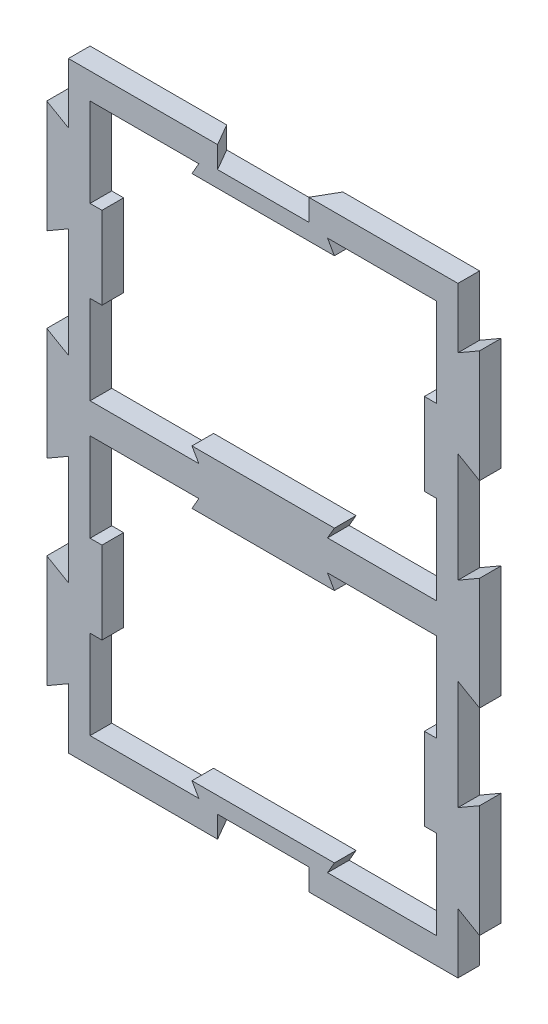
from build123d import *

# Parameters (mm, degrees)
SKETCH2_W           = 139
SKETCH2_H           = 90
SKETCH2_W_2         = 60
SKETCH2_H_2         = 80
BOSS_EXTRUDE1_DEPTH = 5
CUT_EXTRUDE5_DEPTH  = 5
CUT_EXTRUDE6_START  = 134
CUT_EXTRUDE6_DEPTH  = 5
SKETCH12_W          = 2.75
SKETCH12_H          = 19
BOSS_EXTRUDE2_DEPTH = 5


with BuildPart() as part:
    # Sketch2 → Boss-Extrude1 (new body)
    with BuildSketch(Plane(origin=(0, 0, 0), x_dir=(0, 1, 0), z_dir=(0, 0, 1))):
        Rectangle(SKETCH2_W, SKETCH2_H)
        with Locations((33.5, 0)):
            Rectangle(SKETCH2_W_2, SKETCH2_H_2, mode=Mode.SUBTRACT)
        with Locations((-33.5, 0)):
            Rectangle(SKETCH2_W_2, SKETCH2_H_2, mode=Mode.SUBTRACT)
    extrude(amount=BOSS_EXTRUDE1_DEPTH)

    # Sketch13 → Cut-Extrude5 (cut)
    with BuildSketch(Plane(origin=(0, -69.5, -60), x_dir=(1, 0, 0), z_dir=(0, 1, 0))):
        Polygon((-13.423393759, -60), (13.423393759, -60), (0, -83.25), align=None)
    extrude(amount=CUT_EXTRUDE5_DEPTH, mode=Mode.SUBTRACT)

    # Sketch13<3> → Cut-Extrude6 (cut)
    with BuildSketch(Plane(origin=(0, -69.5, -60), x_dir=(1, 0, 0), z_dir=(0, 1, 0)).offset(CUT_EXTRUDE6_START)):
        Polygon((-13.423393759, -60), (13.423393759, -60), (0, -83.25), align=None)
    extrude(amount=CUT_EXTRUDE6_DEPTH, mode=Mode.SUBTRACT)

    # Sketch12 → Boss-Extrude2 (add)
    with BuildSketch(Plane.XY.offset(5)):
        Polygon((-50, 32.519237886), (-45, 35.405989232), (-45, 55.613248654), (-50, 58.5), align=None)
        Polygon((-45, -10.103629711), (-45, 10.103629711), (-50, 12.990381057), (-50, -12.990381057), align=None)
        with Locations((-38.625, 33.5)):
            Rectangle(SKETCH12_W, SKETCH12_H)
        Polygon((-45, -55.613248654), (-45, -35.405989232), (-50, -32.519237886), (-50, -58.5), align=None)
        Polygon((-16.454482672, 6.25), (-14.866769432, 3.5), (14.866769432, 3.5), (16.454482672, 6.25), align=None)
        with Locations((-38.625, -33.5)):
            Rectangle(SKETCH12_W, SKETCH12_H)
        Polygon((14.866769432, 63.5), (-14.866769432, 63.5), (-16.454482672, 60.75), (16.454482672, 60.75), align=None)
        Polygon((-14.866769432, -3.5), (-16.454482672, -6.25), (16.454482672, -6.25), (14.866769432, -3.5), align=None)
        Polygon((-16.454482672, -60.75), (-14.866769432, -63.5), (14.866769432, -63.5), (16.454482672, -60.75), align=None)
        Polygon((50, 58.5), (45, 55.613248654), (45, 35.405989232), (50, 32.519237886), align=None)
        with Locations((38.625, 33.5)):
            Rectangle(SKETCH12_W, SKETCH12_H)
        Polygon((45, -35.405989232), (45, -55.613248654), (50, -58.5), (50, -32.519237886), align=None)
        with Locations((38.625, -33.5)):
            Rectangle(SKETCH12_W, SKETCH12_H)
        Polygon((45, 10.103629711), (45, -10.103629711), (50, -12.990381057), (50, 12.990381057), align=None)
    extrude(amount=-BOSS_EXTRUDE2_DEPTH)


solid = part.part
